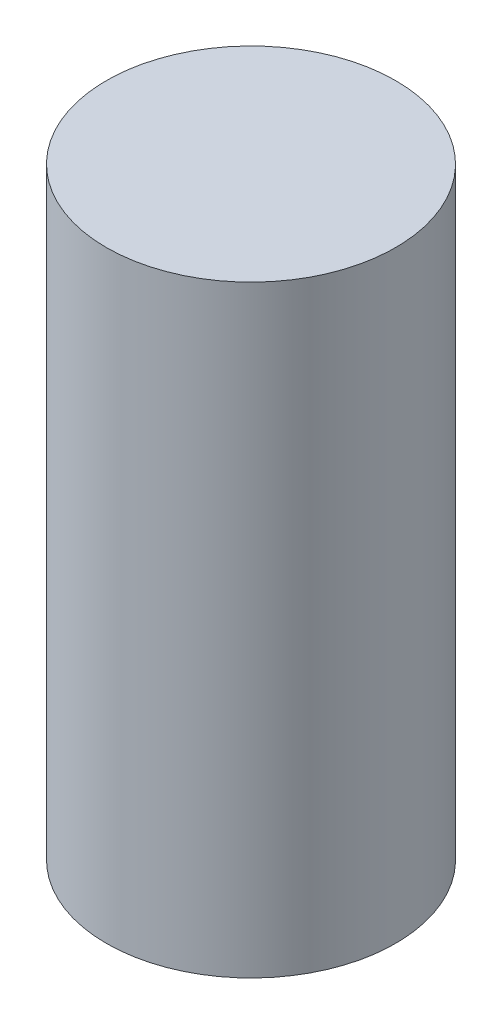
from build123d import *

# Parameters (mm, degrees)
SKETCH1_R           = 4.7625
BOSS_EXTRUDE1_DEPTH = 19.84375


with BuildPart() as part:
    # Sketch1 → Boss-Extrude1 (new body)
    with BuildSketch(Plane(origin=(0, 0, 0), x_dir=(1, 0, 0), z_dir=(0, 1, 0))):
        with Locations(Location((0, 0, 0), (0, 0, 90))):
            Circle(SKETCH1_R)
    extrude(amount=BOSS_EXTRUDE1_DEPTH)


solid = part.part
